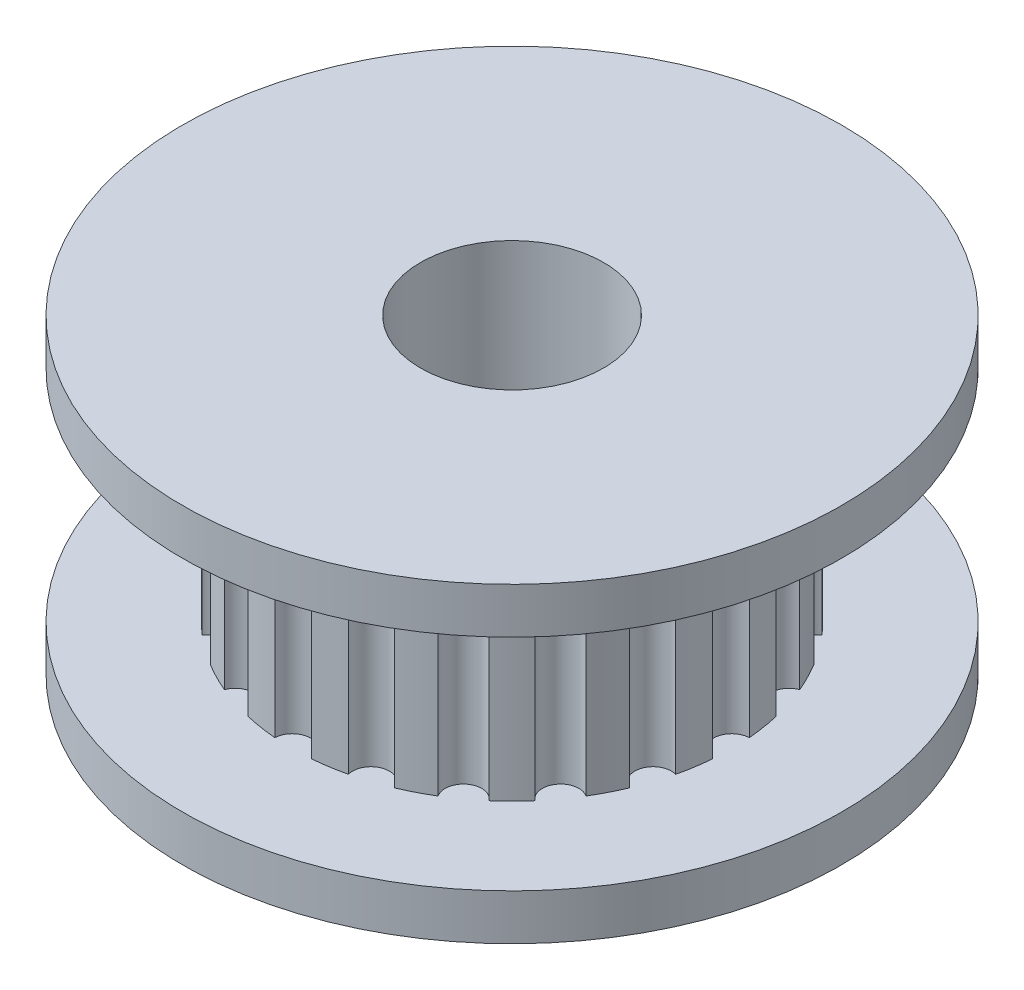
from build123d import *

# Parameters (mm, degrees)
SKETCH_2_R               = 2.5
CUT_EXTRUDE_1_DEPTH      = 10
SKETCH_5_R               = 0.5
CUT_EXTRUDE_3_DEPTH      = 6
PATTERN_CIRCULAR_2_COUNT = 20


with BuildPart() as part:
    # 草图1 → 旋转1 (revolve)
    with BuildSketch(Plane.XY, mode=Mode.PRIVATE) as revolve_1_sk:
        Polygon((0, -8.5), (-9, -8.5), (-9, -7.25), (-6, -7.25), (-6, -1.25), (-9, -1.25), (-9, 0), (0, 0), align=None)
    revolve(revolve_1_sk.sketch.rotate(Axis((0, 0, 0), (0, 1, 0)), 270), axis=Axis((0, 0, 0), (0, 1, 0)))

    # 草图2 → 切除-拉伸1 (cut)
    with BuildSketch(Plane(origin=(0, 0, 0), x_dir=(1, 0, 0), z_dir=(0, 1, 0))):
        with Locations(Location((0, 0, 0), (0, 0, 270))):
            Circle(SKETCH_2_R)
    extrude(amount=-CUT_EXTRUDE_1_DEPTH, mode=Mode.SUBTRACT)

    # 草图5 → 切除-拉伸3 (cut)
    with BuildSketch(Plane.XZ.offset(1.25)):
        with Locations((0, 6)):
            Circle(SKETCH_5_R)
    cut_extrude_3 = extrude(amount=CUT_EXTRUDE_3_DEPTH, mode=Mode.SUBTRACT)

    # 阵列(圆周)2: 切除-拉伸3 ×20 about axis
    pattern_circular_2_axis = Axis((0, 0, 0), (0, 1, 0))
    for i in range(1, PATTERN_CIRCULAR_2_COUNT):
        add(cut_extrude_3.rotate(pattern_circular_2_axis, i * 360 / PATTERN_CIRCULAR_2_COUNT), mode=Mode.SUBTRACT)


solid = part.part
